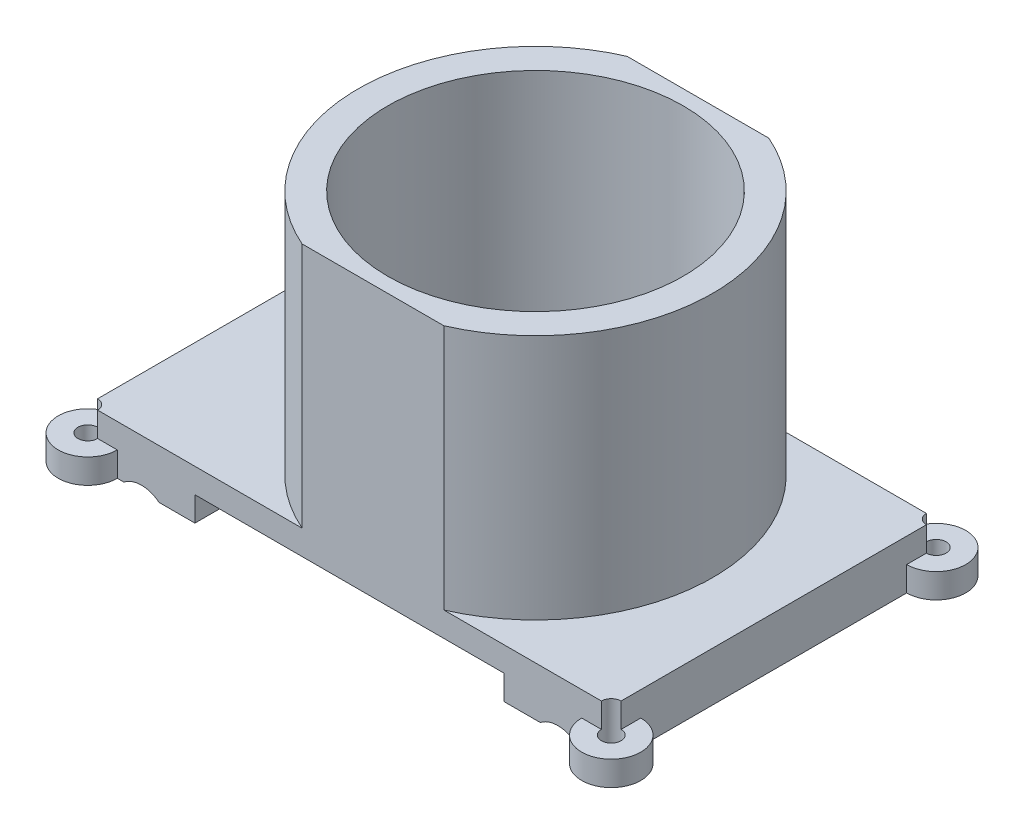
from build123d import *
from build123d.topology import SkipClean

# Parameters (mm, degrees)
SKETCH1_W               = 21.76
SKETCH1_H               = 66
SKETCH1_W_2             = 62.8
BOSS_EXTRUDE1_DEPTH     = 10
SKETCH1_5_W             = 62.8
SKETCH1_5_H             = 66
CUT_EXTRUDE1_DEPTH      = 5
SKETCH3_R               = 7.65
SKETCH3_R_2             = 5.75
CUT_EXTRUDE2_DEPTH      = 62
CUT_EXTRUDE3_DEPTH      = 84.797288739
CUT_EXTRUDE3_DEPTH_BACK = 84.797288739
SKETCH3_3_R             = 5.75
BOSS_EXTRUDE2_DEPTH     = 5
CUT_EXTRUDE4_DEPTH      = 72.560503073
SKETCH5_R               = 30
CUT_EXTRUDE5_DEPTH      = 72.560503073
BOSS_EXTRUDE3_START     = 50
SKETCH5_3_R             = 30
BOSS_EXTRUDE3_DEPTH     = 50


with BuildPart() as part:
    # Sketch1 → Boss-Extrude1 (new body)
    with BuildSketch(Plane(origin=(0, 0, 0), x_dir=(1, 0, 0), z_dir=(0, 1, 0))):
        with Locations((-42.28, 0)):
            Rectangle(SKETCH1_W, SKETCH1_H)
        Rectangle(SKETCH1_W_2, SKETCH1_H)
        with Locations((42.28, 0)):
            Rectangle(SKETCH1_W, SKETCH1_H)
    extrude(amount=BOSS_EXTRUDE1_DEPTH)

    # Sketch1<5> → Cut-Extrude1 (cut)
    with BuildSketch(Plane(origin=(0, 0, 0), x_dir=(1, 0, 0), z_dir=(0, 1, 0))):
        Rectangle(SKETCH1_5_W, SKETCH1_5_H)
    extrude(amount=CUT_EXTRUDE1_DEPTH, mode=Mode.SUBTRACT)

    # Sketch3 → Cut-Extrude2 (cut)
    # profile 1 of 4: a face of its own
    with BuildSketch(Plane.XY.offset(31)):
        with Locations((-42.25, -4.5)):
            Circle(SKETCH3_R)
        with Locations((-42.25, -4.5)):
            Circle(SKETCH3_R_2, mode=Mode.SUBTRACT)
    # profile 2 of 4: a face of its own
    with BuildSketch(Plane.XY.offset(31)):
        with Locations((-42.25, -4.5)):
            Circle(SKETCH3_R_2)
    # profile 3 of 4: a face of its own
    with BuildSketch(Plane.XY.offset(31)):
        with Locations((42.31, -4.5)):
            Circle(SKETCH3_R)
        with Locations((42.31, -4.5)):
            Circle(SKETCH3_R_2, mode=Mode.SUBTRACT)
    # profile 4 of 4: a face of its own
    with BuildSketch(Plane.XY.offset(31)):
        with Locations((42.31, -4.5)):
            Circle(SKETCH3_R_2)
    extrude(amount=-CUT_EXTRUDE2_DEPTH, mode=Mode.SUBTRACT)

    # Sketch3<3> → Cut-Extrude3 (cut, two sides: drawn at the far end of the back side and taken through both)
    with BuildSketch(Plane.XY.offset(31).offset(-CUT_EXTRUDE3_DEPTH_BACK)):
        with Locations((42.31, -4.5)):
            Circle(SKETCH3_3_R)
        with Locations((-42.25, -4.5)):
            Circle(SKETCH3_3_R)
    extrude(amount=CUT_EXTRUDE3_DEPTH + CUT_EXTRUDE3_DEPTH_BACK, mode=Mode.SUBTRACT)

    # Sketch4 → Boss-Extrude2 (add)
    with BuildSketch(Plane.XZ):
        with BuildLine():
            Line((-51.16, 33), (-47.16, 33))
            ThreePointArc((-47.16, 33), (-57.402640687, 37.242640687), (-53.16, 27))
            Line((-53.16, 27), (-53.16, 31))
            ThreePointArc((-53.16, 31), (-54.574213562, 34.414213562), (-51.16, 33))
        make_face()
        with BuildLine():
            ThreePointArc((-53.16, -27), (-57.402640687, -37.242640687), (-47.16, -33))
            Line((-47.16, -33), (-51.16, -33))
            ThreePointArc((-51.16, -33), (-54.574213562, -34.414213562), (-53.16, -31))
            Line((-53.16, -31), (-53.16, -27))
        make_face()
        with BuildLine():
            ThreePointArc((47.16, -33), (57.402640687, -37.242640687), (53.16, -27))
            Line((53.16, -27), (53.16, -31))
            ThreePointArc((53.16, -31), (54.574213562, -34.414213562), (51.16, -33))
            Line((51.16, -33), (47.16, -33))
        make_face()
        with BuildLine():
            ThreePointArc((53.16, 27), (57.402640687, 37.242640687), (47.16, 33))
            Line((47.16, 33), (51.16, 33))
            ThreePointArc((51.16, 33), (54.574213562, 34.414213562), (53.16, 31))
            Line((53.16, 31), (53.16, 27))
        make_face()
    extrude(amount=-BOSS_EXTRUDE2_DEPTH)

    # Sketch4<3> → Cut-Extrude4 (cut, through all)
    with SkipClean():  # the faces are left unmerged after this step: merging them gives an invalid solid
        with BuildSketch(Plane.XZ):
            with BuildLine():
                ThreePointArc((51.16, 33), (51.745786438, 31.585786438), (53.16, 31))
                Line((53.16, 31), (53.16, 33))
                Line((53.16, 33), (51.16, 33))
            make_face()
            with BuildLine():
                Line((53.16, 33), (53.16, 31))
                ThreePointArc((53.16, 31), (54.574213562, 31.585786438), (55.16, 33))
                ThreePointArc((55.16, 33), (53.16, 35), (51.16, 33))
                Line((51.16, 33), (53.16, 33))
            make_face()
            with BuildLine():
                ThreePointArc((55.16, -33), (54.574213562, -31.585786438), (53.16, -31))
                Line((53.16, -31), (53.16, -33))
                Line((53.16, -33), (51.16, -33))
                ThreePointArc((51.16, -33), (53.16, -35), (55.16, -33))
            make_face()
            with BuildLine():
                Line((53.16, -33), (53.16, -31))
                ThreePointArc((53.16, -31), (51.745786438, -31.585786438), (51.16, -33))
                Line((51.16, -33), (53.16, -33))
            make_face()
            with BuildLine():
                ThreePointArc((-53.16, -31), (-54.574213562, -34.414213562), (-51.16, -33))
                Line((-51.16, -33), (-53.16, -33))
                Line((-53.16, -33), (-53.16, -31))
            make_face()
            with BuildLine():
                Line((-53.16, -33), (-51.16, -33))
                ThreePointArc((-51.16, -33), (-51.745786438, -31.585786438), (-53.16, -31))
                Line((-53.16, -31), (-53.16, -33))
            make_face()
            with BuildLine():
                ThreePointArc((-53.16, 31), (-51.745786438, 31.585786438), (-51.16, 33))
                Line((-51.16, 33), (-53.16, 33))
                Line((-53.16, 33), (-53.16, 31))
            make_face()
            with BuildLine():
                Line((-53.16, 33), (-51.16, 33))
                ThreePointArc((-51.16, 33), (-54.574213562, 34.414213562), (-53.16, 31))
                Line((-53.16, 31), (-53.16, 33))
            make_face()
        extrude(amount=-CUT_EXTRUDE4_DEPTH, mode=Mode.SUBTRACT)

    # Sketch5 → Cut-Extrude5 (cut, through all)
    with SkipClean():  # the faces are left unmerged after this step: merging them gives an invalid solid
        with BuildSketch(Plane(origin=(0, 10, 0), x_dir=(1, 0, 0), z_dir=(0, 1, 0))):
            with Locations(Location((4.77, 0, 0), (0, 0, 270))):
                Circle(SKETCH5_R)
        extrude(amount=-CUT_EXTRUDE5_DEPTH, mode=Mode.SUBTRACT)

    # Sketch5<3> → Boss-Extrude3 (add)
    with SkipClean():  # the faces are left unmerged after this step: merging them gives an invalid solid
        with BuildSketch(Plane(origin=(0, 10, 0), x_dir=(1, 0, 0), z_dir=(0, 1, 0)).offset(BOSS_EXTRUDE3_START)):
            with BuildLine():
                Line((-9.61749457, -33), (19.15749457, -33))
                ThreePointArc((19.15749457, -33), (34.886024011, -19.723719166), (40.77, 0))
                ThreePointArc((40.77, 0), (34.886024011, 19.723719166), (19.15749457, 33))
                Line((19.15749457, 33), (-9.61749457, 33))
                ThreePointArc((-9.61749457, 33), (-31.23, 0), (-9.61749457, -33))
            make_face()
            with Locations(Location((4.77, 0, 0), (0, 0, 270))):
                Circle(SKETCH5_3_R, mode=Mode.SUBTRACT)
        extrude(amount=-BOSS_EXTRUDE3_DEPTH)


solid = part.part
